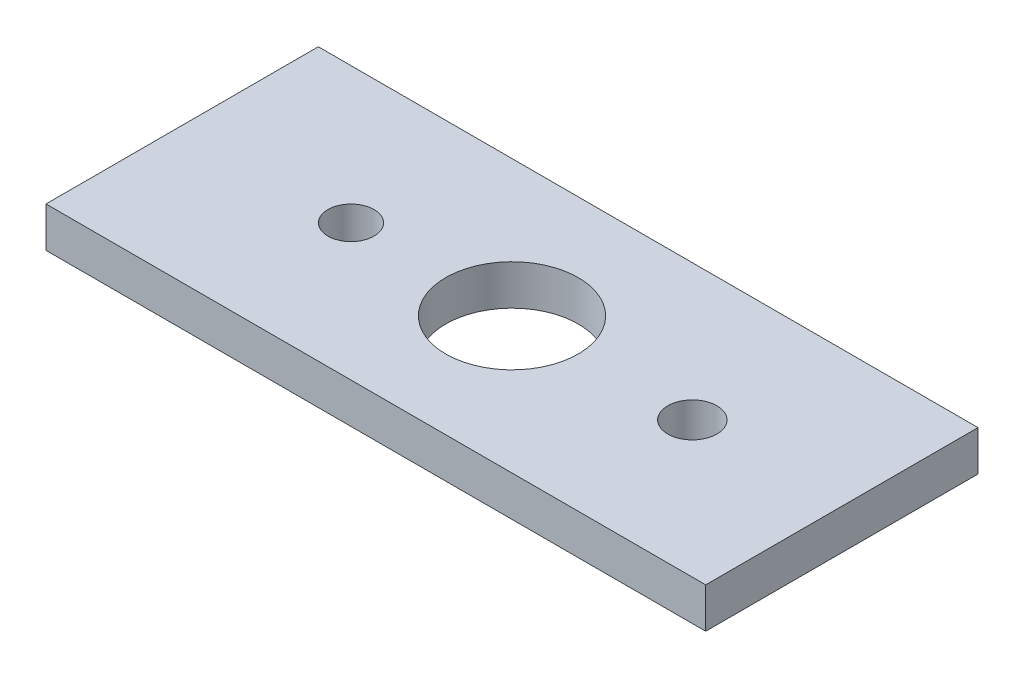
from build123d import *

# Parameters (mm, degrees)
SKETCH1_W           = 164.056213182
SKETCH1_H           = 67.71790731
BOSS_EXTRUDE1_DEPTH = 10
SKETCH2_R           = 5.733448678
CUT_EXTRUDE1_DEPTH  = 10
SKETCH4_R           = 6.106577878
CUT_EXTRUDE2_DEPTH  = 10
SKETCH6_R           = 16.472289059
CUT_EXTRUDE3_DEPTH  = 10


with BuildPart() as part:
    # Sketch1 → Boss-Extrude1 (new body)
    with BuildSketch(Plane(origin=(0, 0, 0), x_dir=(1, 0, 0), z_dir=(0, 1, 0))):
        Rectangle(SKETCH1_W, SKETCH1_H)
    extrude(amount=BOSS_EXTRUDE1_DEPTH)

    # Sketch2 → Cut-Extrude1 (cut)
    with BuildSketch(Plane(origin=(0, 10, 0), x_dir=(1, 0, 0), z_dir=(0, 1, 0))):
        with Locations(Location((-40.043133624, 0, 0), (0, 0, 270))):
            Circle(SKETCH2_R)
    extrude(amount=-CUT_EXTRUDE1_DEPTH, mode=Mode.SUBTRACT)

    # Sketch4 → Cut-Extrude2 (cut)
    with BuildSketch(Plane(origin=(0, 10, 0), x_dir=(1, 0, 0), z_dir=(0, 1, 0))):
        with Locations(Location((44.848309659, 0, 0), (0, 0, 270))):
            Circle(SKETCH4_R)
    extrude(amount=-CUT_EXTRUDE2_DEPTH, mode=Mode.SUBTRACT)

    # Sketch6 → Cut-Extrude3 (cut)
    with BuildSketch(Plane(origin=(0, 10, 0), x_dir=(1, 0, 0), z_dir=(0, 1, 0))):
        with Locations(Location((0, 0, 0), (0, 0, 270))):
            Circle(SKETCH6_R)
    extrude(amount=-CUT_EXTRUDE3_DEPTH, mode=Mode.SUBTRACT)


solid = part.part
